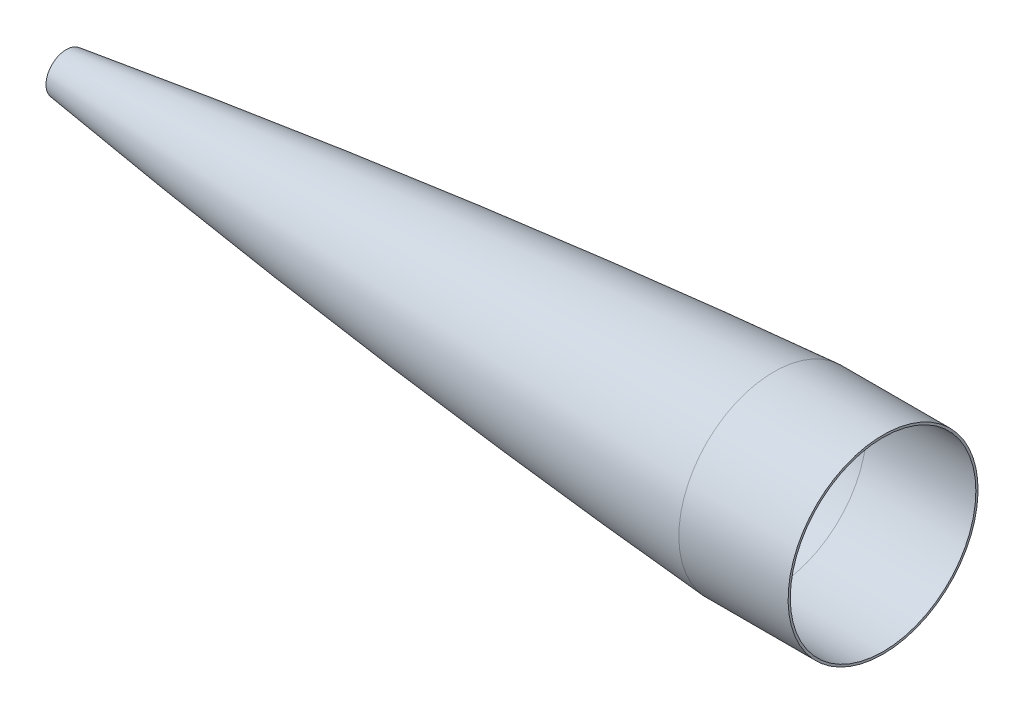
from build123d import *

# Parameters (mm, degrees)
SKETCH14_W         = 99.852899645
SKETCH14_H         = 2
CUT_EXTRUDE1_DEPTH = 50


with BuildPart() as part:
    # Sketch1 → Revolve1 (revolve)
    with BuildSketch(Plane(origin=(0, 0, 0), x_dir=(-1, 0, 0), z_dir=(0, 0, -1)), mode=Mode.PRIVATE) as revolve1_sk:
        with BuildLine():
            Line((-763.382394472, 85), (-763.235294117, 85))
            ThreePointArc((-763.235294117, 85), (-380.825050597, 49.616912867), (0, 0))
            Line((0, 0), (18.46847438, 0))
            Line((18.46847438, 0), (0.295326728, 1.978075358))
            ThreePointArc((0.295326728, 1.978075358), (-380.640283603, 51.608700281), (-763.161647781, 87))
            Line((-763.161647781, 87), (-763.382394472, 87))
            Line((-763.382394472, 87), (-763.382394472, 85))
        make_face()
    revolve(revolve1_sk.sketch.rotate(Axis((763.235294117, 0, 0), (-1, 0, 0)), 180), axis=Axis((763.235294117, 0, 0), (-1, 0, 0)))

    # Sketch14 → Revolve4 (revolve)
    with BuildSketch(Plane(origin=(0, 0, 0), x_dir=(-1, 0, 0), z_dir=(0, 0, -1)), mode=Mode.PRIVATE) as revolve4_sk:
        with Locations((-813.308844295, 86)):
            Rectangle(SKETCH14_W, SKETCH14_H)
    revolve(revolve4_sk.sketch.rotate(Axis((763.235294117, 0, 0), (1, 0, 0)), 180), axis=Axis((763.235294117, 0, 0), (1, 0, 0)))

    # Sketch15 → Cut-Extrude1 (cut, symmetric)
    with BuildSketch(Plane.XY):
        Polygon((-1798.394426372, -1.080422086), (-17.779665104, -0.07497417), (114.997091286, 0), (114.997091286, 42.308767364), (-24.793740749, 42.308767364), (-24.793740749, -36.098631976), (114.997091286, -36.098631976), (114.997091286, 0), (114.997091286, 1780.615045137), (-2311.882223875, 4386.879909942), (-4225.273741533, 2605.184442719), align=None)
    extrude(amount=CUT_EXTRUDE1_DEPTH, both=True, mode=Mode.SUBTRACT)


with BuildPart() as cut_extrude1_kept_piece:
    # of the separate pieces the step leaves, the one the design keeps (cut_extrude1_pieces_kept)
    add(part.part.solids().sort_by_distance((763.161647781, -87, 0))[0])


solid = cut_extrude1_kept_piece.part
